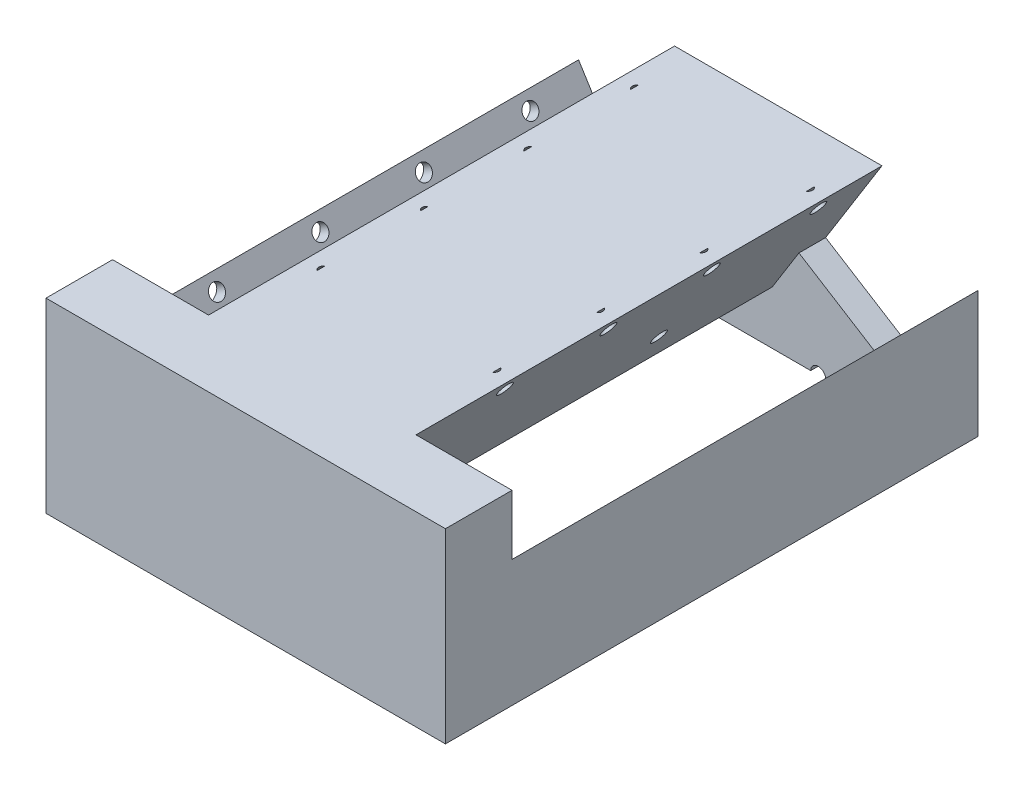
from build123d import *

# Parameters (mm, degrees)
SKETCH_1_W          = 30
SKETCH_1_H          = 14
EXTRUDE_1_DEPTH     = 40
CUT_EXTRUDE_1_DEPTH = 35
SKETCH_4_W          = 27
SKETCH_4_H          = 36
CUT_EXTRUDE_2_DEPTH = 7.21308
SKETCH_5_R          = 0.565
CUT_EXTRUDE_3_DEPTH = 10
EXTRUDE_2_REACH     = 53.923
SKETCH_6_R          = 0.565
CUT_EXTRUDE_4_DEPTH = 1
SKETCH_8_R          = 0.565
CUT_EXTRUDE_5_DEPTH = 51.1269475


with BuildPart() as part:
    # 草图1 → 凸台-拉伸1 (new body)
    with BuildSketch(Plane.XY):
        with Locations((15, -7)):
            Rectangle(SKETCH_1_W, SKETCH_1_H)
    extrude(amount=EXTRUDE_1_DEPTH)

    # 草图3 → 切除-拉伸1 (cut)
    with BuildSketch(Plane(origin=(0, 0, 0), x_dir=(-1, 0, 0), z_dir=(0, 0, -1))):
        Polygon((-30, -4.5), (-25.764705882, -11.286920048), (-18.553603331, -6.786920048), (-22.788897449, 0), (-30, 0), align=None)
        Polygon((-7.211102551, 0), (-11.446396669, -6.786920048), (-4.235294118, -11.286920048), (0, -4.5), (0, 0), align=None)
    extrude(amount=-CUT_EXTRUDE_1_DEPTH, mode=Mode.SUBTRACT)

    # 草图4 → 切除-拉伸2 (cut)
    with BuildSketch(Plane.XZ.offset(14)):
        with Locations((15, 20)):
            Rectangle(SKETCH_4_W, SKETCH_4_H)
    extrude(amount=-CUT_EXTRUDE_2_DEPTH, mode=Mode.SUBTRACT)

    # 草图5 → 切除-拉伸3 (cut)
    with BuildSketch(Plane(origin=(0, 0, 0), x_dir=(-1, 0, 0), z_dir=(0, 0, -1))):
        with Locations((-10, -14)):
            Circle(SKETCH_5_R)
        with Locations((-20, -14)):
            Circle(SKETCH_5_R)
    extrude(amount=-CUT_EXTRUDE_3_DEPTH, mode=Mode.SUBTRACT)

    # 草图7 → 凸台-拉伸2 (add, up to next)
    with BuildSketch(Plane(origin=(0, 0, 0), x_dir=(-1, 0, 0), z_dir=(0, 0, -1)), mode=Mode.PRIVATE) as extrude_2_sk1:
        Polygon((-22.788897449, 0), (-18.553603331, -6.786920048), (-16.548520242, -10), (-13.451479758, -10), (-11.446396669, -6.786920048), (-7.211102551, 0), align=None)
    extrude_2_tool1 = extrude(extrude_2_sk1.sketch, amount=-EXTRUDE_2_REACH, mode=Mode.PRIVATE) - part.part
    add(extrude_2_tool1.solids().sort_by_distance((15, -3.886134, 0))[0])

    # 草图6 → 切除-拉伸4 (cut)
    with BuildSketch(Plane(origin=(5.189997684, 3.238754325, 0), x_dir=(0, 0, 1), z_dir=(-0.8483650059915271, -0.5294117647058821, 0))):
        with Locations(Location((12.2, -12.417642527, 0), (0, 0, 270))):
            Circle(SKETCH_6_R)
        with Locations(Location((12.2, -4.917642527, 0), (0, 0, 270))):
            Circle(SKETCH_6_R)
        with Locations(Location((4.2, -4.917642527, 0), (0, 0, 270))):
            Circle(SKETCH_6_R)
        with Locations(Location((19.97, -4.917642527, 0), (0, 0, 270))):
            Circle(SKETCH_6_R)
        with Locations(Location((27.74, -4.917642527, 0), (0, 0, 270))):
            Circle(SKETCH_6_R)
    cut_extrude_4 = extrude(amount=-CUT_EXTRUDE_4_DEPTH, mode=Mode.SUBTRACT)

    # 镜向1: 切除-拉伸4 across plane
    add(cut_extrude_4.mirror(Plane(origin=(15, 0, 0), x_dir=(0, 0, 1), z_dir=(1, 0, 0))), mode=Mode.SUBTRACT)

    # 草图8 → 切除-拉伸5 (cut, through all)
    with BuildSketch(Plane(origin=(5.189997684, 3.238754325, 0), x_dir=(0, 0, 1), z_dir=(-0.8483650059915271, -0.5294117647058821, 0))):
        with Locations(Location((12.2, -12.417642527, 0), (0, 0, 270))):
            Circle(SKETCH_8_R)
        with Locations(Location((4.2, -4.917642527, 0), (0, 0, 270))):
            Circle(SKETCH_8_R)
        with Locations(Location((27.74, -4.917642527, 0), (0, 0, 270))):
            Circle(SKETCH_8_R)
        with Locations(Location((19.97, -4.917642527, 0), (0, 0, 270))):
            Circle(SKETCH_8_R)
        with Locations(Location((12.2, -4.917642527, 0), (0, 0, 270))):
            Circle(SKETCH_8_R)
    extrude(amount=CUT_EXTRUDE_5_DEPTH, mode=Mode.SUBTRACT)


solid = part.part
